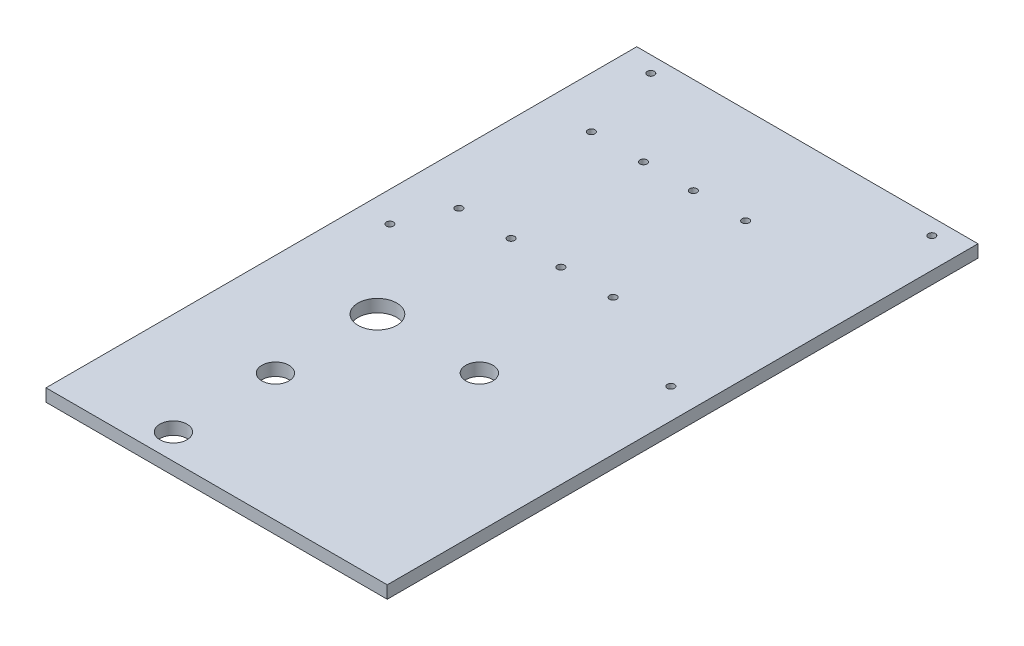
from build123d import *

# Parameters (mm, degrees)
SKETCH1_W           = 85
SKETCH1_H           = 147.15
SKETCH1_R           = 4.826
SKETCH1_R_2         = 3.38
SKETCH1_R_3         = 0.889
BOSS_EXTRUDE1_DEPTH = 3.125


with BuildPart() as part:
    # Sketch1 → Boss-Extrude1 (new body)
    with BuildSketch(Plane(origin=(0, 0, 0), x_dir=(1, 0, 0), z_dir=(0, 1, 0))):
        with Locations((42.5, 73.575)):
            Rectangle(SKETCH1_W, SKETCH1_H)
        with Locations(Location((25.4, 57.15, 0), (0, 0, 270))):
            Circle(SKETCH1_R, mode=Mode.SUBTRACT)
        with Locations(Location((25.4, 31.75, 0), (0, 0, 270))):
            Circle(SKETCH1_R_2, mode=Mode.SUBTRACT)
        with Locations(Location((25.4, 6.35, 0), (0, 0, 270))):
            Circle(SKETCH1_R_2, mode=Mode.SUBTRACT)
        with Locations(Location((50.8, 57.15, 0), (0, 0, 270))):
            Circle(SKETCH1_R_2, mode=Mode.SUBTRACT)
        with Locations(Location((7.5, 143.15, 0), (0, 0, 270))):
            Circle(SKETCH1_R_3, mode=Mode.SUBTRACT)
        with Locations(Location((77.5, 143.15, 0), (0, 0, 270))):
            Circle(SKETCH1_R_3, mode=Mode.SUBTRACT)
        with Locations(Location((77.5, 78.15, 0), (0, 0, 270))):
            Circle(SKETCH1_R_3, mode=Mode.SUBTRACT)
        with Locations(Location((7.5, 78.15, 0), (0, 0, 270))):
            Circle(SKETCH1_R_3, mode=Mode.SUBTRACT)
        with Locations(Location((12.7, 123.15, 0), (0, 0, 270))):
            Circle(SKETCH1_R_3, mode=Mode.SUBTRACT)
        with Locations(Location((25.7, 90.15, 0), (0, 0, 270))):
            Circle(SKETCH1_R_3, mode=Mode.SUBTRACT)
        with Locations(Location((25.7, 123.15, 0), (0, 0, 270))):
            Circle(SKETCH1_R_3, mode=Mode.SUBTRACT)
        with Locations(Location((12.7, 90.15, 0), (0, 0, 270))):
            Circle(SKETCH1_R_3, mode=Mode.SUBTRACT)
        with Locations(Location((38.1, 123.15, 0), (0, 0, 270))):
            Circle(SKETCH1_R_3, mode=Mode.SUBTRACT)
        with Locations(Location((51.1, 123.15, 0), (0, 0, 270))):
            Circle(SKETCH1_R_3, mode=Mode.SUBTRACT)
        with Locations(Location((51.1, 90.15, 0), (0, 0, 270))):
            Circle(SKETCH1_R_3, mode=Mode.SUBTRACT)
        with Locations(Location((38.1, 90.15, 0), (0, 0, 270))):
            Circle(SKETCH1_R_3, mode=Mode.SUBTRACT)
    extrude(amount=BOSS_EXTRUDE1_DEPTH)


solid = part.part
